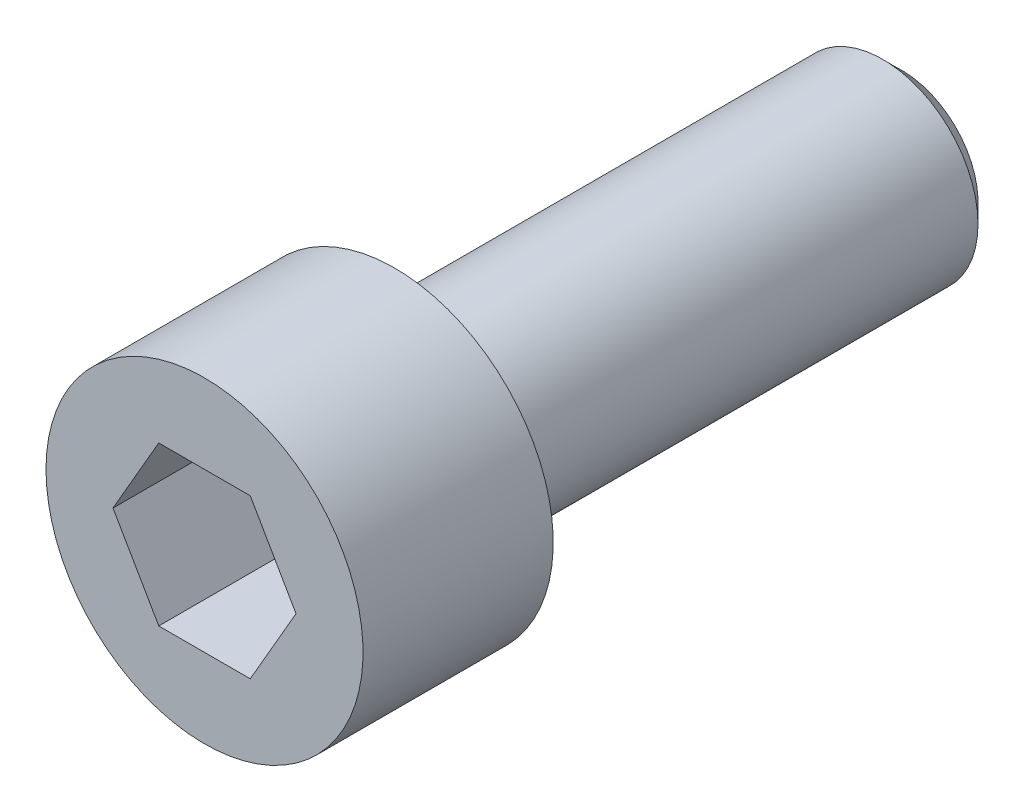
from build123d import *

# Parameters (mm, degrees)
CUT_EXTRUDE_1_DEPTH = 2
FILLET_1_R          = 0.3
CHAMFER_1_SIZE      = 0.3


with BuildPart() as part:
    # Эскиз1 → Повернуть1 (revolve)
    with BuildSketch(Plane(origin=(0, 0, 0), x_dir=(0, 0, -1), z_dir=(1, 0, 0)), mode=Mode.PRIVATE) as revolve_1_sk:
        Polygon((0, 0), (0, 2.5), (3, 2.5), (3, 1.5), (11, 1.5), (11, 0), align=None)
    revolve(revolve_1_sk.sketch.rotate(Axis((0, 0, 0), (0, 0, 1)), 90), axis=Axis((0, 0, 0), (0, 0, 1)))

    # Эскиз2 → Вырез-Вытянуть1 (cut)
    with BuildSketch(Plane.XY):
        Polygon((1.443375673, 0), (0.721687836, 1.25), (-0.721687836, 1.25), (-1.443375673, 0), (-0.721687836, -1.25), (0.721687836, -1.25), align=None)
    extrude(amount=-CUT_EXTRUDE_1_DEPTH, mode=Mode.SUBTRACT)

    # Скругление1
    fillet_1_edges = [part.edges().sort_by_distance(p)[0] for p in [
        (1.5, 0, -3),
    ]]
    fillet(fillet_1_edges, radius=FILLET_1_R)

    # Фаска1
    chamfer_1_edges = [part.edges().sort_by_distance(p)[0] for p in [
        (1.5, 0, -11),
    ]]
    chamfer(chamfer_1_edges, length=CHAMFER_1_SIZE)


solid = part.part
